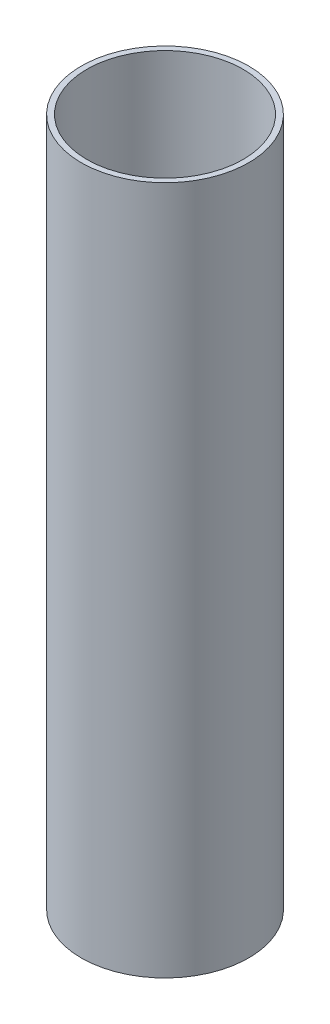
from build123d import *

# Parameters (mm, degrees)
SKETCH_1_R      = 22.5
SKETCH_1_R_2    = 21
EXTRUDE_1_DEPTH = 185


with BuildPart() as part:
    # 草图1 → 凸台-拉伸1 (new body)
    with BuildSketch(Plane(origin=(0, 0, 0), x_dir=(1, 0, 0), z_dir=(0, 1, 0))):
        with Locations(Location((0, 0, 0), (0, 0, 270))):
            Circle(SKETCH_1_R)
        with Locations(Location((0, 0, 0), (0, 0, 270))):
            Circle(SKETCH_1_R_2, mode=Mode.SUBTRACT)
    extrude(amount=EXTRUDE_1_DEPTH)


solid = part.part
